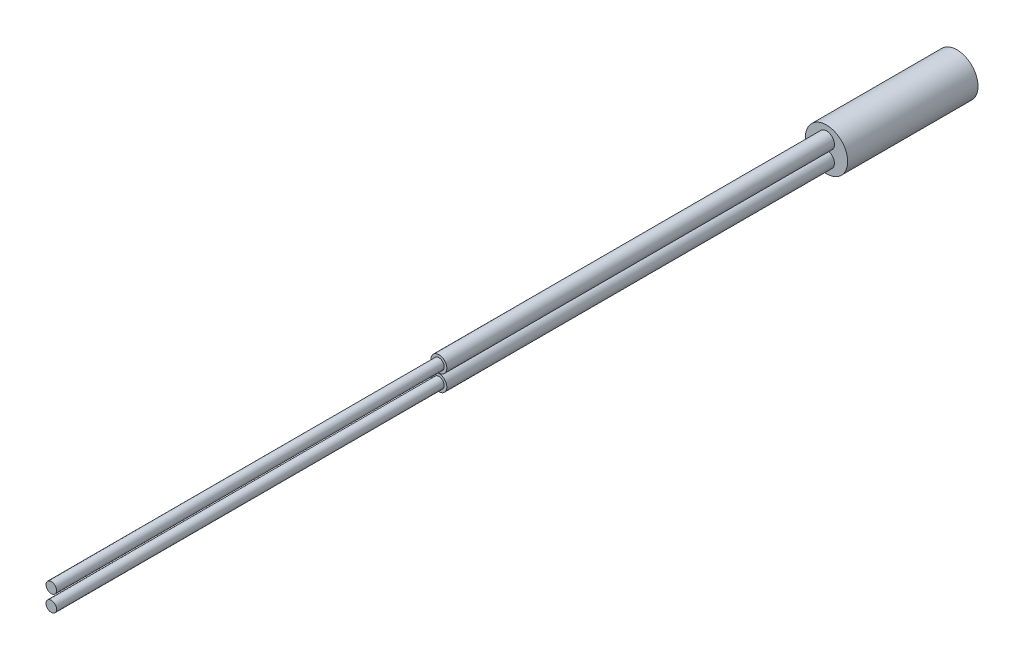
from build123d import *

# Parameters (mm, degrees)
CROQUIS1_R                   = 3
SALIENTE_EXTRUIR1_DEPTH      = 18
SALIENTE_EXTRUIR2_DEPTH      = 21.5
SALIENTE_EXTRUIR2_DEPTH_BACK = 1.5
CROQUIS1_2_R                 = 3
CROQUIS3_R                   = 3
CORTAR_EXTRUIR1_DEPTH        = 4.5
CROQUIS9_R                   = 1.125
SALIENTE_EXTRUIR3_DEPTH      = 55
CROQUIS10_R                  = 0.75
SALIENTE_EXTRUIR4_DEPTH      = 110


with BuildPart() as part:
    # Croquis1 → Saliente-Extruir1 (new body)
    with BuildSketch(Plane.XY):
        Circle(CROQUIS1_R)
    extrude(amount=SALIENTE_EXTRUIR1_DEPTH)

    # Croquis1<2> → Saliente-Extruir2 (add, two sides: drawn at the far end of the back side and taken through both)
    with BuildSketch(Plane.XY.offset(-SALIENTE_EXTRUIR2_DEPTH_BACK)):
        Circle(CROQUIS1_2_R)
    extrude(amount=SALIENTE_EXTRUIR2_DEPTH + SALIENTE_EXTRUIR2_DEPTH_BACK)

    # Croquis3 → Cortar-Extruir1 (cut)
    with BuildSketch(Plane(origin=(0, 0, -1.5), x_dir=(-1, 0, 0), z_dir=(0, 0, -1))):
        Circle(CROQUIS3_R)
    extrude(amount=-CORTAR_EXTRUIR1_DEPTH, mode=Mode.SUBTRACT)

    # Croquis9 → Saliente-Extruir3 (add)
    with BuildSketch(Plane.XY.offset(21.5)):
        with Locations((0, -1.15)):
            Circle(CROQUIS9_R)
        with Locations((0, 1.15)):
            Circle(CROQUIS9_R)
    extrude(amount=SALIENTE_EXTRUIR3_DEPTH)

    # Croquis10 → Saliente-Extruir4 (add)
    with BuildSketch(Plane.XY.offset(21.5)):
        with Locations((0, -1.15)):
            Circle(CROQUIS10_R)
        with Locations((0, 1.15)):
            Circle(CROQUIS10_R)
    extrude(amount=SALIENTE_EXTRUIR4_DEPTH)


solid = part.part
